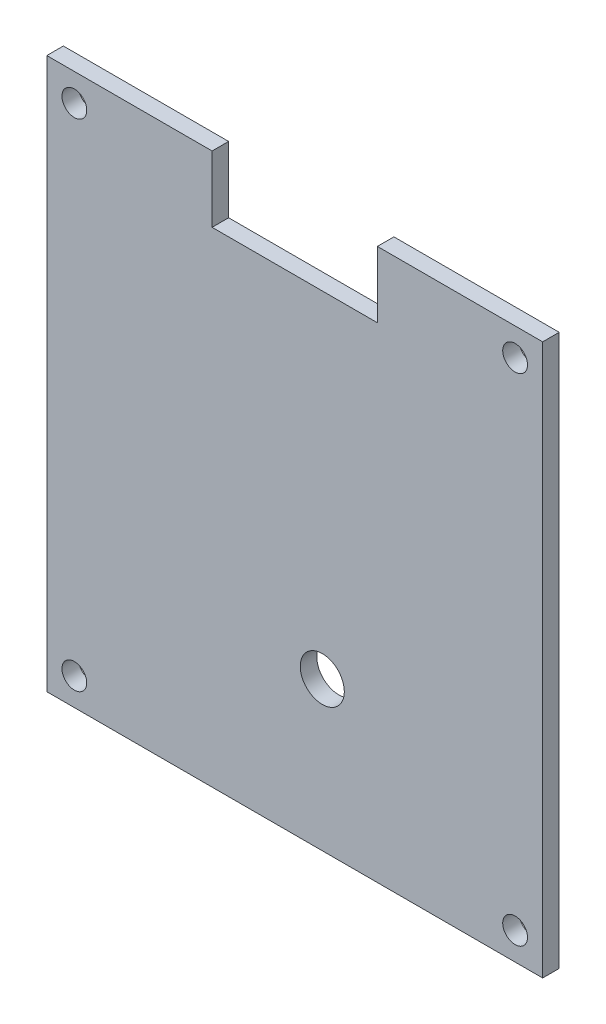
from build123d import *

# Parameters (mm, degrees)
SKETCH1_R           = 4
SKETCH1_R_2         = 2.25
BOSS_EXTRUDE1_DEPTH = 3


with BuildPart() as part:
    # Sketch1 → Boss-Extrude1 (new body)
    with BuildSketch(Plane(origin=(0, 0, 0), x_dir=(-1, 0, 0), z_dir=(0, 0, -1))):
        Polygon((15, 50), (15, 38), (-15, 38), (-15, 50), (-45, 50), (-45, -50), (45, -50), (45, 50), align=None)
        with Locations(Location((-5, -23, 0), (0, 0, 180))):
            Circle(SKETCH1_R, mode=Mode.SUBTRACT)
        with Locations(Location((40, 45, 0), (0, 0, 180))):
            Circle(SKETCH1_R_2, mode=Mode.SUBTRACT)
        with Locations(Location((-40, 45, 0), (0, 0, 180))):
            Circle(SKETCH1_R_2, mode=Mode.SUBTRACT)
        with Locations(Location((-40, -45, 0), (0, 0, 180))):
            Circle(SKETCH1_R_2, mode=Mode.SUBTRACT)
        with Locations(Location((40, -45, 0), (0, 0, 180))):
            Circle(SKETCH1_R_2, mode=Mode.SUBTRACT)
    extrude(amount=-BOSS_EXTRUDE1_DEPTH)


solid = part.part
